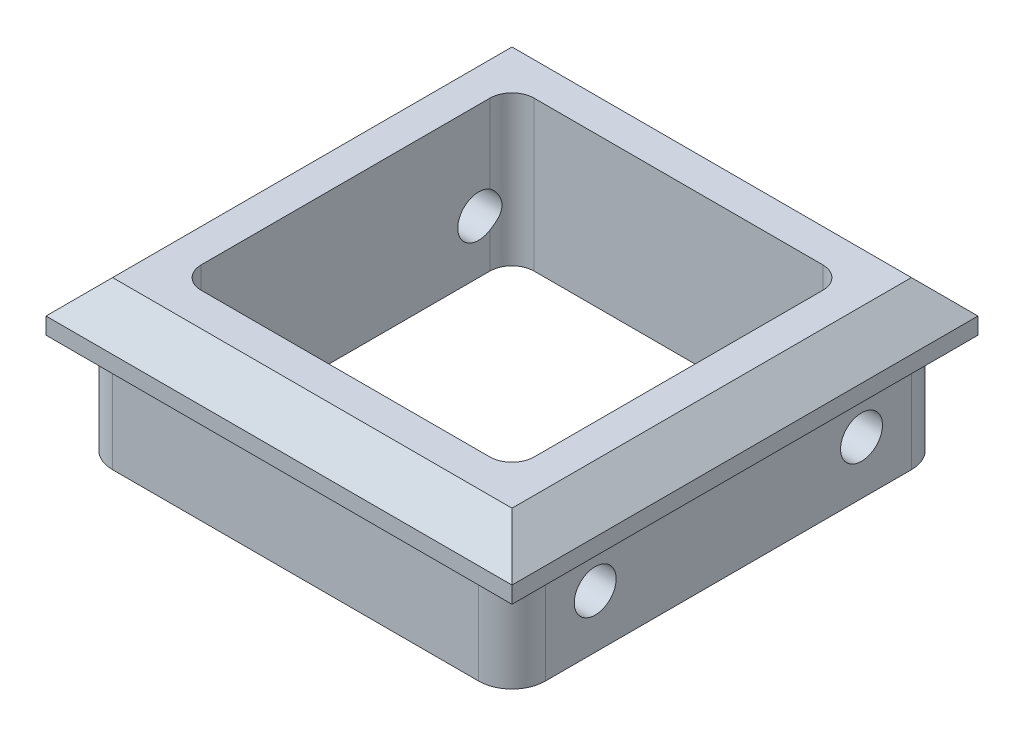
from build123d import *

# Parameters (mm, degrees)
SKETCH1_W           = 82.55
SKETCH1_H           = 82.55
BOSS_EXTRUDE1_DEPTH = 19.05
BOSS_EXTRUDE2_START = 19.05
SKETCH1_3_W         = 88.9
SKETCH1_3_H         = 88.9
SKETCH1_3_W_2       = 82.55
SKETCH1_3_H_2       = 82.55
BOSS_EXTRUDE2_DEPTH = 9.525
FILLET1_R           = 6.35
CHAMFER1_SIZE       = 6.35
SKETCH2_R           = 4
CUT_EXTRUDE2_DEPTH  = 101.703072197


with BuildPart() as part:
    # Sketch1 → Boss-Extrude1 (new body)
    with BuildSketch(Plane(origin=(0, 0, 0), x_dir=(1, 0, 0), z_dir=(0, 1, 0))):
        Rectangle(SKETCH1_W, SKETCH1_H)
        with BuildLine():
            ThreePointArc((-27.5336, 31.75), (-30.515045032, 30.515045032), (-31.75, 27.5336))
            Line((-31.75, 27.5336), (-31.75, -27.5336))
            ThreePointArc((-31.75, -27.5336), (-30.515045032, -30.515045032), (-27.5336, -31.75))
            Line((-27.5336, -31.75), (27.5336, -31.75))
            ThreePointArc((27.5336, -31.75), (30.515045032, -30.515045032), (31.75, -27.5336))
            Line((31.75, -27.5336), (31.75, 27.5336))
            ThreePointArc((31.75, 27.5336), (30.515045032, 30.515045032), (27.5336, 31.75))
            Line((27.5336, 31.75), (-27.5336, 31.75))
        make_face(mode=Mode.SUBTRACT)
    extrude(amount=BOSS_EXTRUDE1_DEPTH)

    # Sketch1<3> → Boss-Extrude2 (add)
    # profile 1 of 2: a face of its own
    with BuildSketch(Plane(origin=(0, 0, 0), x_dir=(1, 0, 0), z_dir=(0, 1, 0)).offset(BOSS_EXTRUDE2_START)):
        Rectangle(SKETCH1_3_W, SKETCH1_3_H)
        Rectangle(SKETCH1_3_W_2, SKETCH1_3_H_2, mode=Mode.SUBTRACT)
    # profile 2 of 2: a face of its own
    with BuildSketch(Plane(origin=(0, 0, 0), x_dir=(1, 0, 0), z_dir=(0, 1, 0)).offset(BOSS_EXTRUDE2_START)):
        Rectangle(SKETCH1_3_W_2, SKETCH1_3_H_2)
        with BuildLine():
            ThreePointArc((-27.5336, 31.75), (-30.515045032, 30.515045032), (-31.75, 27.5336))
            Line((-31.75, 27.5336), (-31.75, -27.5336))
            ThreePointArc((-31.75, -27.5336), (-30.515045032, -30.515045032), (-27.5336, -31.75))
            Line((-27.5336, -31.75), (27.5336, -31.75))
            ThreePointArc((27.5336, -31.75), (30.515045032, -30.515045032), (31.75, -27.5336))
            Line((31.75, -27.5336), (31.75, 27.5336))
            ThreePointArc((31.75, 27.5336), (30.515045032, 30.515045032), (27.5336, 31.75))
            Line((27.5336, 31.75), (-27.5336, 31.75))
        make_face(mode=Mode.SUBTRACT)
    extrude(amount=BOSS_EXTRUDE2_DEPTH)

    # Fillet1
    fillet1_edges = [part.edges().sort_by_distance(p)[0] for p in [
        (41.275, 9.525, -41.275),
        (41.275, 9.525, 41.275),
        (-41.275, 9.525, 41.275),
        (-41.275, 9.525, -41.275),
    ]]
    fillet(fillet1_edges, radius=FILLET1_R)

    # Chamfer1
    chamfer1_edges = [part.edges().sort_by_distance(p)[0] for p in [
        (44.45, 28.575, 0),
        (0, 28.575, 44.45),
        (0, 28.575, -44.45),
        (-44.45, 28.575, 0),
    ]]
    chamfer(chamfer1_edges, length=CHAMFER1_SIZE)

    # Sketch2 → Cut-Extrude2 (cut, through all)
    with BuildSketch(Plane.ZY.offset(41.275)):
        with Locations(Location((-25.4, 10.16, 0), (0, 0, 237.764531712))):
            Circle(SKETCH2_R)
        with Locations(Location((25.4, 10.16, 0), (0, 0, 57.764531712))):
            Circle(SKETCH2_R)
    extrude(amount=-CUT_EXTRUDE2_DEPTH, mode=Mode.SUBTRACT)


solid = part.part
